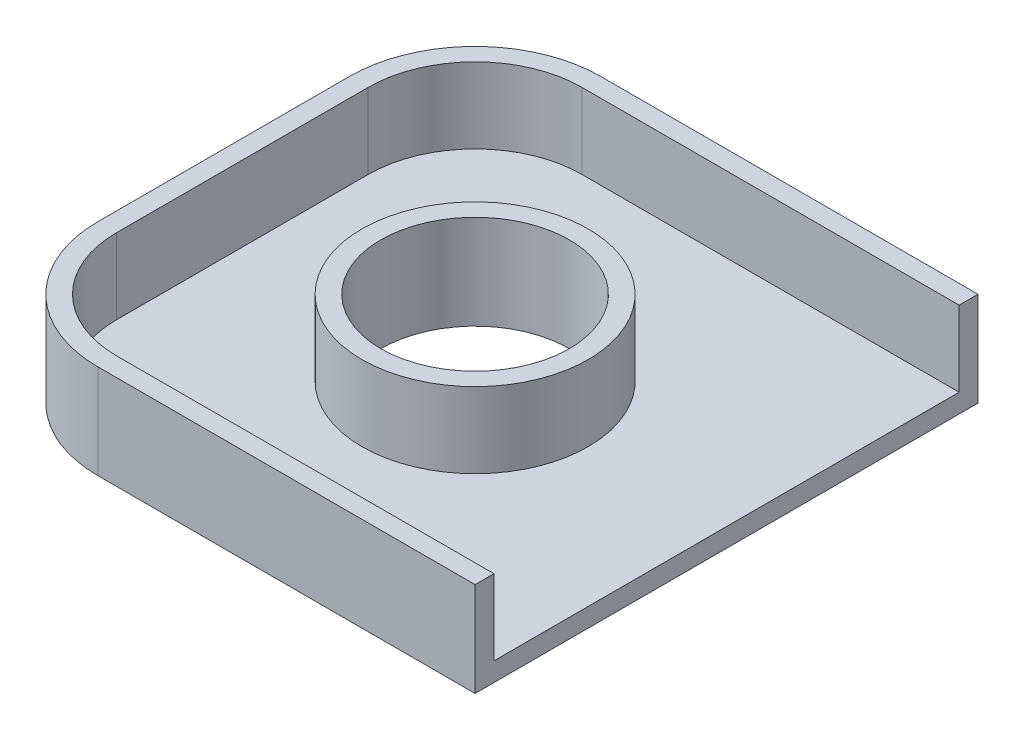
from build123d import *

# Parameters (mm, degrees)
SKETCH_1_W               = 80
SKETCH_1_H               = 80
EXTRUDE_1_DEPTH          = 15
FILLET_1_R               = 20
SHELL_1_T                = -3
SKETCH_2_R               = 18
EXTRUDE_2_DEPTH          = 12
CUT_EXTRUDE_1_DEPTH      = 15
CUT_EXTRUDE_1_DEPTH_BACK = 15
SKETCH_2_3_R             = 15


with BuildPart() as part:
    # 스케치1 → 보스-돌출1 (new body)
    with BuildSketch(Plane(origin=(0, 0, 0), x_dir=(1, 0, 0), z_dir=(0, 1, 0))):
        with Locations((40, 40)):
            Rectangle(SKETCH_1_W, SKETCH_1_H)
    extrude(amount=EXTRUDE_1_DEPTH)

    # 필렛1
    fillet_1_edges = [part.edges().sort_by_distance(p)[0] for p in [
        (0, 7.5, -80),
        (0, 7.5, 0),
    ]]
    fillet(fillet_1_edges, radius=FILLET_1_R)

    # 쉘1
    shell_1_openings = [part.faces().sort_by_distance(p)[0] for p in [
        (80, 7.5, -40),
        (40.979445098, 15, -40),
    ]]
    offset(amount=SHELL_1_T, openings=shell_1_openings, kind=Kind.INTERSECTION)

    # 스케치2 → 보스-돌출2 (add)
    with BuildSketch(Plane(origin=(0, 3, 0), x_dir=(1, 0, 0), z_dir=(0, 1, 0))):
        with Locations((40, 40)):
            Circle(SKETCH_2_R)
    extrude(amount=EXTRUDE_2_DEPTH)

    # 스케치2<3> → 컷-돌출1 (cut, two sides: drawn at the far end of the back side and taken through both)
    with BuildSketch(Plane(origin=(0, 3, 0), x_dir=(1, 0, 0), z_dir=(0, 1, 0)).offset(-CUT_EXTRUDE_1_DEPTH_BACK)):
        with Locations((40, 40)):
            Circle(SKETCH_2_3_R)
    extrude(amount=CUT_EXTRUDE_1_DEPTH + CUT_EXTRUDE_1_DEPTH_BACK, mode=Mode.SUBTRACT)


solid = part.part
